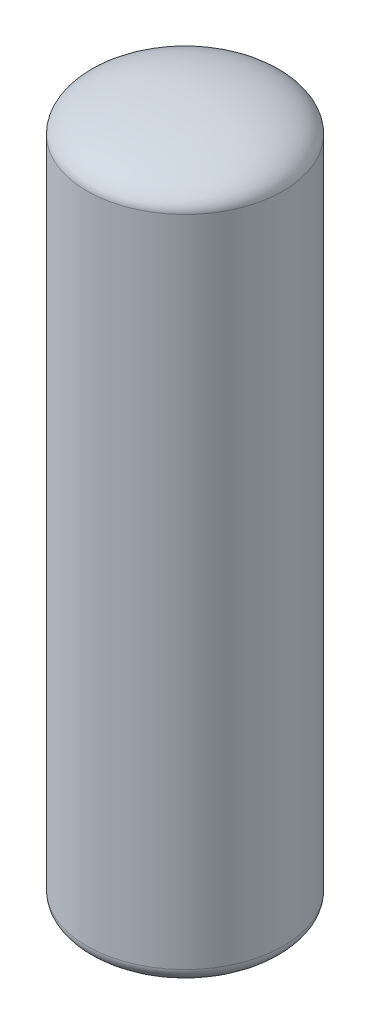
from build123d import *

# Parameters (mm, degrees)
ESQUISSE1_R        = 3
BOSS_EXTRU_1_DEPTH = 20
D_ME1_FACE_RADIUS  = 3
D_ME1_HEIGHT       = 1
D_ME2_FACE_RADIUS  = 3
D_ME2_HEIGHT       = 1


with BuildPart() as part:
    # Esquisse1 → Boss.-Extru.1 (new body)
    with BuildSketch(Plane(origin=(0, 0, 0), x_dir=(1, 0, 0), z_dir=(0, 1, 0))):
        Circle(ESQUISSE1_R)
    extrude(amount=BOSS_EXTRU_1_DEPTH)

    # Dôme1: an elliptical dome of height H over a round flat face of radius A is half a spheroid: the quarter ellipse of half axes A and H revolved about the face's axis
    with BuildSketch(Plane((0, 20, 0), x_dir=(0, 0, -1), z_dir=(1, 0, 0)), mode=Mode.PRIVATE) as d_me1_quarter:
        Ellipse(D_ME1_FACE_RADIUS, D_ME1_HEIGHT)
        Rectangle(D_ME1_FACE_RADIUS, D_ME1_HEIGHT, align=(Align.MIN, Align.MIN), mode=Mode.INTERSECT)
    revolve(d_me1_quarter.sketch, axis=Axis((0, 20, 0), (0, 1, 0)))

    # Dôme2: an elliptical dome of height H over a round flat face of radius A is half a spheroid: the quarter ellipse of half axes A and H revolved about the face's axis
    with BuildSketch(Plane((0, 0, 0), x_dir=(0, 0, 1), z_dir=(1, 0, 0)), mode=Mode.PRIVATE) as d_me2_quarter:
        Ellipse(D_ME2_FACE_RADIUS, D_ME2_HEIGHT)
        Rectangle(D_ME2_FACE_RADIUS, D_ME2_HEIGHT, align=(Align.MIN, Align.MIN), mode=Mode.INTERSECT)
    revolve(d_me2_quarter.sketch, axis=Axis((0, 0, 0), (0, -1, 0)))


solid = part.part
